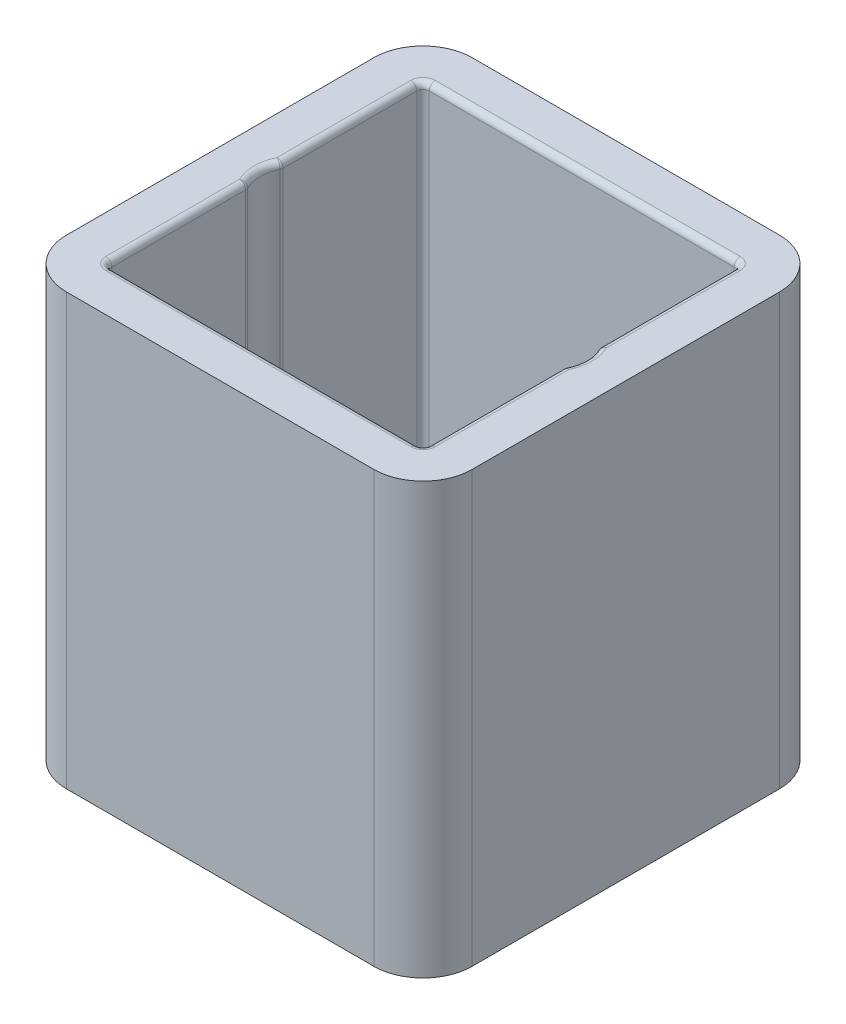
from build123d import *

# Parameters (mm, degrees)
SKIZZE1_W                       = 33
SKIZZE1_H                       = 33
SKIZZE1_R                       = 1.7
SKIZZE1_R_2                     = 5.5
AUFSATZ_LINEAR_AUSTRAGEN1_DEPTH = 5
SKIZZE2_W                       = 33
SKIZZE2_H                       = 33
AUFSATZ_LINEAR_AUSTRAGEN2_DEPTH = 30
VERRUNDUNG1_R                   = 4
VERRUNDUNG4_R                   = 0.5
VERRUNDUNG5_R                   = 0.5


with BuildPart() as part:
    # Skizze1 → Aufsatz-Linear austragen1 (new body)
    with BuildSketch(Plane(origin=(0, 0, 0), x_dir=(1, 0, 0), z_dir=(0, 1, 0))):
        Rectangle(SKIZZE1_W, SKIZZE1_H)
        with Locations(Location((10.25, 0, 0), (0, 0, 270))):
            Circle(SKIZZE1_R, mode=Mode.SUBTRACT)
        with Locations(Location((5.125, -8.876760389, 0), (0, 0, 270))):
            Circle(SKIZZE1_R, mode=Mode.SUBTRACT)
        with Locations(Location((-5.125, -8.876760389, 0), (0, 0, 270))):
            Circle(SKIZZE1_R, mode=Mode.SUBTRACT)
        with Locations(Location((-10.25, 0, 0), (0, 0, 270))):
            Circle(SKIZZE1_R, mode=Mode.SUBTRACT)
        with Locations(Location((-5.125, 8.876760389, 0), (0, 0, 270))):
            Circle(SKIZZE1_R, mode=Mode.SUBTRACT)
        with Locations(Location((5.125, 8.876760389, 0), (0, 0, 270))):
            Circle(SKIZZE1_R, mode=Mode.SUBTRACT)
        with Locations(Location((0, 0, 0), (0, 0, 270))):
            Circle(SKIZZE1_R_2, mode=Mode.SUBTRACT)
    extrude(amount=-AUFSATZ_LINEAR_AUSTRAGEN1_DEPTH)

    # Skizze2 → Aufsatz-Linear austragen2 (add)
    with BuildSketch(Plane(origin=(0, 0, 0), x_dir=(1, 0, 0), z_dir=(0, 1, 0))):
        Rectangle(SKIZZE2_W, SKIZZE2_H)
        with BuildLine():
            Line((12.9, 12.9), (7.592597401, 12.9))
            Line((7.592597401, 12.9), (-2.657402599, 12.9))
            Line((-2.657402599, 12.9), (-12.9, 12.9))
            Line((-12.9, 12.9), (-12.9, 3.905508149))
            Line((-12.9, 3.905508149), (-12.9, 1.406236111))
            ThreePointArc((-12.9, 1.406236111), (-13.25, 0), (-12.9, -1.406236111))
            Line((-12.9, -1.406236111), (-12.9, -12.9))
            Line((-12.9, -12.9), (-7.592597401, -12.9))
            Line((-7.592597401, -12.9), (12.9, -12.9))
            Line((12.9, -12.9), (12.9, -3.905508149))
            Line((12.9, -3.905508149), (12.9, -1.406236111))
            ThreePointArc((12.9, -1.406236111), (13.25, 0), (12.9, 1.406236111))
            Line((12.9, 1.406236111), (12.9, 12.9))
        make_face(mode=Mode.SUBTRACT)
    extrude(amount=AUFSATZ_LINEAR_AUSTRAGEN2_DEPTH)

    # Verrundung1
    verrundung1_edges = [part.edges().sort_by_distance(p)[0] for p in [
        (-16.5, 12.5, -16.5),
        (16.5, 12.5, -16.5),
        (16.5, 12.5, 16.5),
        (-16.5, 12.5, 16.5),
    ]]
    fillet(verrundung1_edges, radius=VERRUNDUNG1_R)

    # Verrundung4
    verrundung4_edges = [part.edges().sort_by_distance(p)[0] for p in [
        (-10.25, 0, -1.7),
        (-5.125, 0, -10.576760389),
        (5.125, 0, -10.576760389),
        (10.25, 0, -1.7),
        (-5.125, 0, 7.176760389),
        (5.125, 0, 7.176760389),
        (0, 0, -5.5),
    ]]
    fillet(verrundung4_edges, radius=VERRUNDUNG4_R)

    # Verrundung5
    verrundung5_edges = [part.edges().sort_by_distance(p)[0] for p in [
        (12.9, 0, -7.153118056),
        (0, 0, -12.9),
        (-12.9, 0, -7.153118056),
        (-13.25, 0, 0),
        (-12.9, 0, 7.153118056),
        (0, 0, 12.9),
        (12.9, 0, 7.153118056),
        (13.25, 0, 0),
        (12.9, 30, -7.153118056),
        (12.9, 15, -12.9),
        (0, 30, -12.9),
        (-12.9, 15, -12.9),
        (-12.9, 30, -7.153118056),
        (-12.9, 15, -1.406236111),
        (-13.25, 30, 0),
        (-12.9, 15, 1.406236111),
        (-12.9, 30, 7.153118056),
        (-12.9, 15, 12.9),
        (0, 30, 12.9),
        (12.9, 15, 12.9),
        (12.9, 30, 7.153118056),
        (12.9, 15, 1.406236111),
        (13.25, 30, 0),
        (12.9, 15, -1.406236111),
    ]]
    fillet(verrundung5_edges, radius=VERRUNDUNG5_R)


solid = part.part
